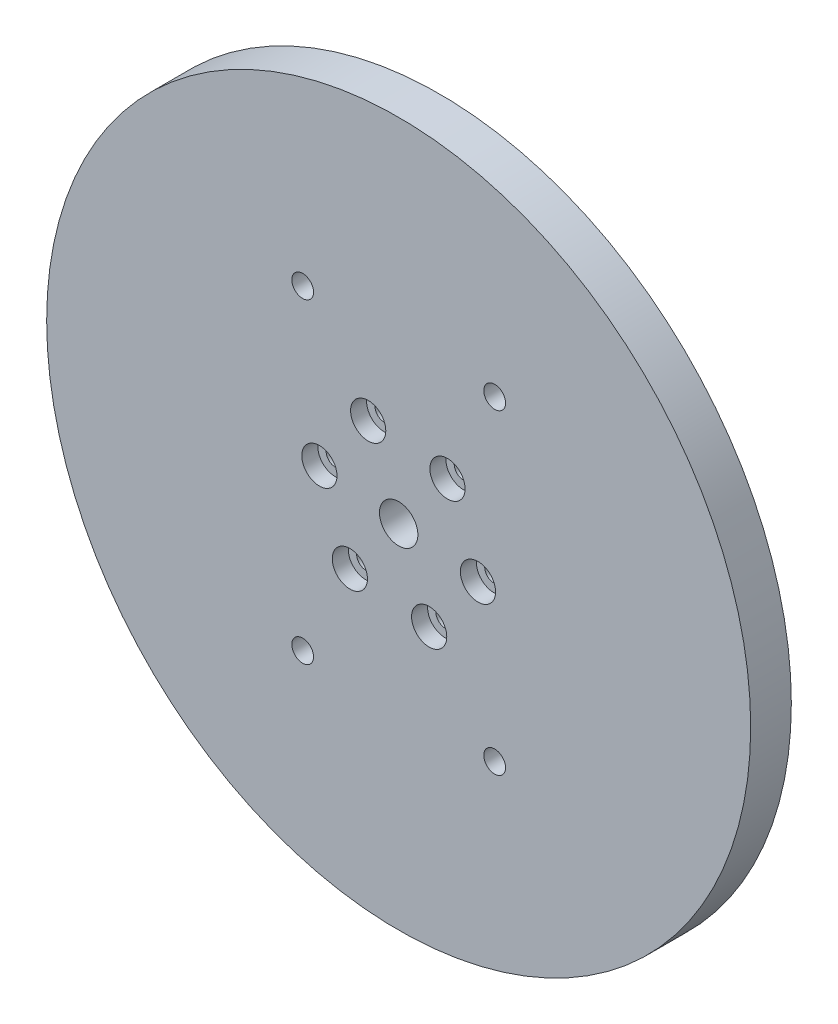
from build123d import *

# Parameters (mm, degrees)
DISCO_START                  = 420
SK_DISCO_R                   = 55
DISCO_DEPTH                  = 6.35
PASANTES_M2_5_ROTOR_J4_START = 420
SK_PASANTES_M2_5_ROTOR_J4_R  = 1.45
PASANTES_M2_5_ROTOR_J4_DEPTH = 6.35
CAJAS_M2_5_START             = 423.85
SK_CAJAS_M2_5_R              = 2.75
CAJAS_M2_5_DEPTH             = 2.5
PASO_CABLE_START             = 420
SK_PASO_CABLE_R              = 3
PASO_CABLE_DEPTH             = 6.35
SK_PASANTES_M3_PAREDES_R     = 1.7
PASANTES_M3_PAREDES_DEPTH    = 79.040518322
SK_CAJAS_M3_PAREDES_R        = 3.25
CAJAS_M3_PAREDES_DEPTH       = 3.5


with BuildPart() as part:
    # Sk_Disco → Disco (new body)
    with BuildSketch(Plane.XY.offset(DISCO_START)):
        Circle(SK_DISCO_R)
    extrude(amount=DISCO_DEPTH)

    # Sk_Pasantes_M2-5_rotor_J4 → Pasantes_M2-5_rotor_J4 (cut)
    with BuildSketch(Plane.XY.offset(PASANTES_M2_5_ROTOR_J4_START)):
        with Locations((12.390194253, -1.653204878)):
            Circle(SK_PASANTES_M2_5_ROTOR_J4_R)
        with Locations((7.626814549, 9.903620542)):
            Circle(SK_PASANTES_M2_5_ROTOR_J4_R)
        with Locations((-4.763379704, 11.55682542)):
            Circle(SK_PASANTES_M2_5_ROTOR_J4_R)
        with Locations((-12.390194253, 1.653204878)):
            Circle(SK_PASANTES_M2_5_ROTOR_J4_R)
        with Locations((-7.626814549, -9.903620542)):
            Circle(SK_PASANTES_M2_5_ROTOR_J4_R)
        with Locations((4.763379704, -11.55682542)):
            Circle(SK_PASANTES_M2_5_ROTOR_J4_R)
    extrude(amount=PASANTES_M2_5_ROTOR_J4_DEPTH, mode=Mode.SUBTRACT)

    # Sk_Cajas_M2-5 → Cajas_M2-5 (cut)
    with BuildSketch(Plane.XY.offset(CAJAS_M2_5_START)):
        with Locations((12.390194253, -1.653204878)):
            Circle(SK_CAJAS_M2_5_R)
        with Locations((7.626814549, 9.903620542)):
            Circle(SK_CAJAS_M2_5_R)
        with Locations((-4.763379704, 11.55682542)):
            Circle(SK_CAJAS_M2_5_R)
        with Locations((-12.390194253, 1.653204878)):
            Circle(SK_CAJAS_M2_5_R)
        with Locations((-7.626814549, -9.903620542)):
            Circle(SK_CAJAS_M2_5_R)
        with Locations((4.763379704, -11.55682542)):
            Circle(SK_CAJAS_M2_5_R)
    extrude(amount=CAJAS_M2_5_DEPTH, mode=Mode.SUBTRACT)

    # Sk_Paso_cable → Paso_cable (cut)
    with BuildSketch(Plane.XY.offset(PASO_CABLE_START)):
        Circle(SK_PASO_CABLE_R)
    extrude(amount=PASO_CABLE_DEPTH, mode=Mode.SUBTRACT)

    # Sk_Pasantes_M3_paredes → Pasantes_M3_paredes (cut, through all)
    with BuildSketch(Plane.XY.offset(426.35)):
        with Locations((-15, -24.675)):
            Circle(SK_PASANTES_M3_PAREDES_R)
        with Locations((15, -24.675)):
            Circle(SK_PASANTES_M3_PAREDES_R)
        with Locations((-15, 24.675)):
            Circle(SK_PASANTES_M3_PAREDES_R)
        with Locations((15, 24.675)):
            Circle(SK_PASANTES_M3_PAREDES_R)
    extrude(amount=-PASANTES_M3_PAREDES_DEPTH, mode=Mode.SUBTRACT)

    # Sk_Cajas_M3_paredes → Cajas_M3_paredes (cut)
    with BuildSketch(Plane(origin=(0, 0, 420), x_dir=(-1, 0, 0), z_dir=(0, 0, -1))):
        with Locations((15, -24.675)):
            Circle(SK_CAJAS_M3_PAREDES_R)
        with Locations((-15, -24.675)):
            Circle(SK_CAJAS_M3_PAREDES_R)
        with Locations((15, 24.675)):
            Circle(SK_CAJAS_M3_PAREDES_R)
        with Locations((-15, 24.675)):
            Circle(SK_CAJAS_M3_PAREDES_R)
    extrude(amount=-CAJAS_M3_PAREDES_DEPTH, mode=Mode.SUBTRACT)


solid = part.part
